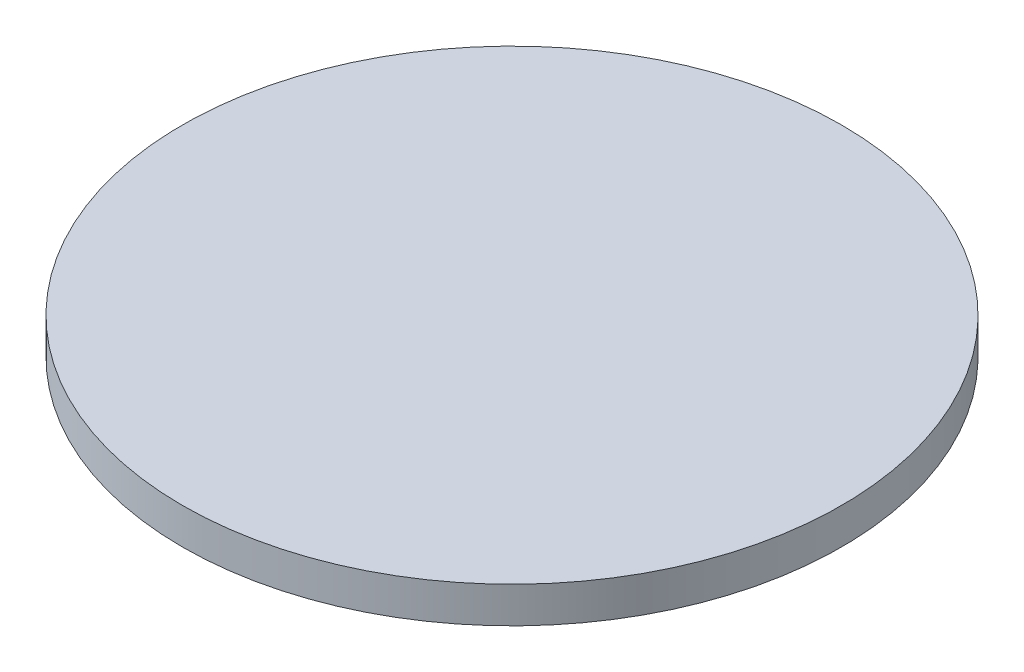
from build123d import *

# Parameters (mm, degrees)
SKETCH_1_R      = 64
EXTRUDE_1_DEPTH = 7


with BuildPart() as part:
    # 草图1 → 凸台-拉伸1 (new body)
    with BuildSketch(Plane(origin=(0, 0, 0), x_dir=(1, 0, 0), z_dir=(0, 1, 0))):
        with Locations(Location((0, 0, 0), (0, 0, 270))):
            Circle(SKETCH_1_R)
    extrude(amount=EXTRUDE_1_DEPTH)


solid = part.part
